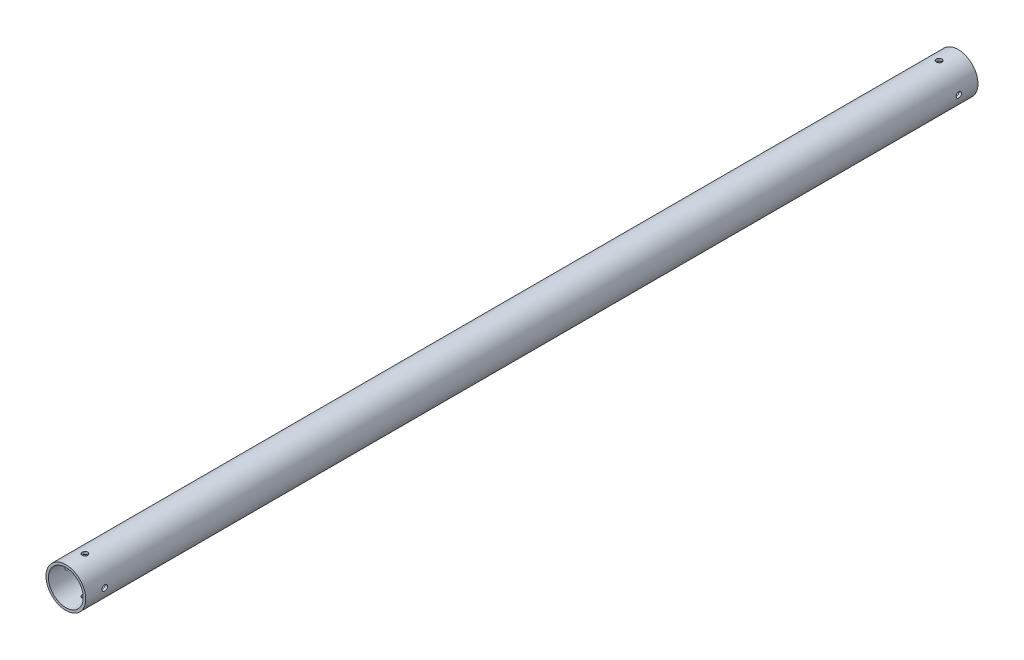
from build123d import *

# Parameters (mm, degrees)
SKETCH2_R               = 12.7
SKETCH2_R_2             = 11.1125
BOSS_EXTRUDE1_DEPTH     = 285.09415041
CUT_EXTRUDE1_DEPTH      = 286.659333119
CUT_EXTRUDE1_DEPTH_BACK = 286.659333119
SKETCH3_R               = 1.7526
CUT_EXTRUDE2_DEPTH      = 286.659333228
CUT_EXTRUDE2_DEPTH_BACK = 286.659333228
SKETCH4_R               = 1.7526


with BuildPart() as part:
    # Sketch2 → Boss-Extrude1 (new, symmetric)
    with BuildSketch(Plane.XY):
        Circle(SKETCH2_R)
        Circle(SKETCH2_R_2, mode=Mode.SUBTRACT)
    extrude(amount=BOSS_EXTRUDE1_DEPTH, both=True)

    # Sketch3 → Cut-Extrude1 (cut, two sides: drawn at the far end of the back side and taken through both)
    with BuildSketch(Plane(origin=(0, 0, 0), x_dir=(1, 0, 0), z_dir=(0, 1, 0)).offset(-CUT_EXTRUDE1_DEPTH_BACK)):
        with Locations(Location((0, -272.90215041, 0), (0, 0, 270))):
            Circle(SKETCH3_R)
        with Locations(Location((0, 272.90215041, 0), (0, 0, 270))):
            Circle(SKETCH3_R)
    extrude(amount=CUT_EXTRUDE1_DEPTH + CUT_EXTRUDE1_DEPTH_BACK, mode=Mode.SUBTRACT)

    # Sketch4 → Cut-Extrude2 (cut, two sides: drawn at the far end of the back side and taken through both)
    with BuildSketch(Plane(origin=(0, 0, 0), x_dir=(0, 0, -1), z_dir=(1, 0, 0)).offset(-CUT_EXTRUDE2_DEPTH_BACK)):
        with Locations((-272.90215041, 0)):
            Circle(SKETCH4_R)
        with Locations((272.90215041, 0)):
            Circle(SKETCH4_R)
    extrude(amount=CUT_EXTRUDE2_DEPTH + CUT_EXTRUDE2_DEPTH_BACK, mode=Mode.SUBTRACT)


solid = part.part
